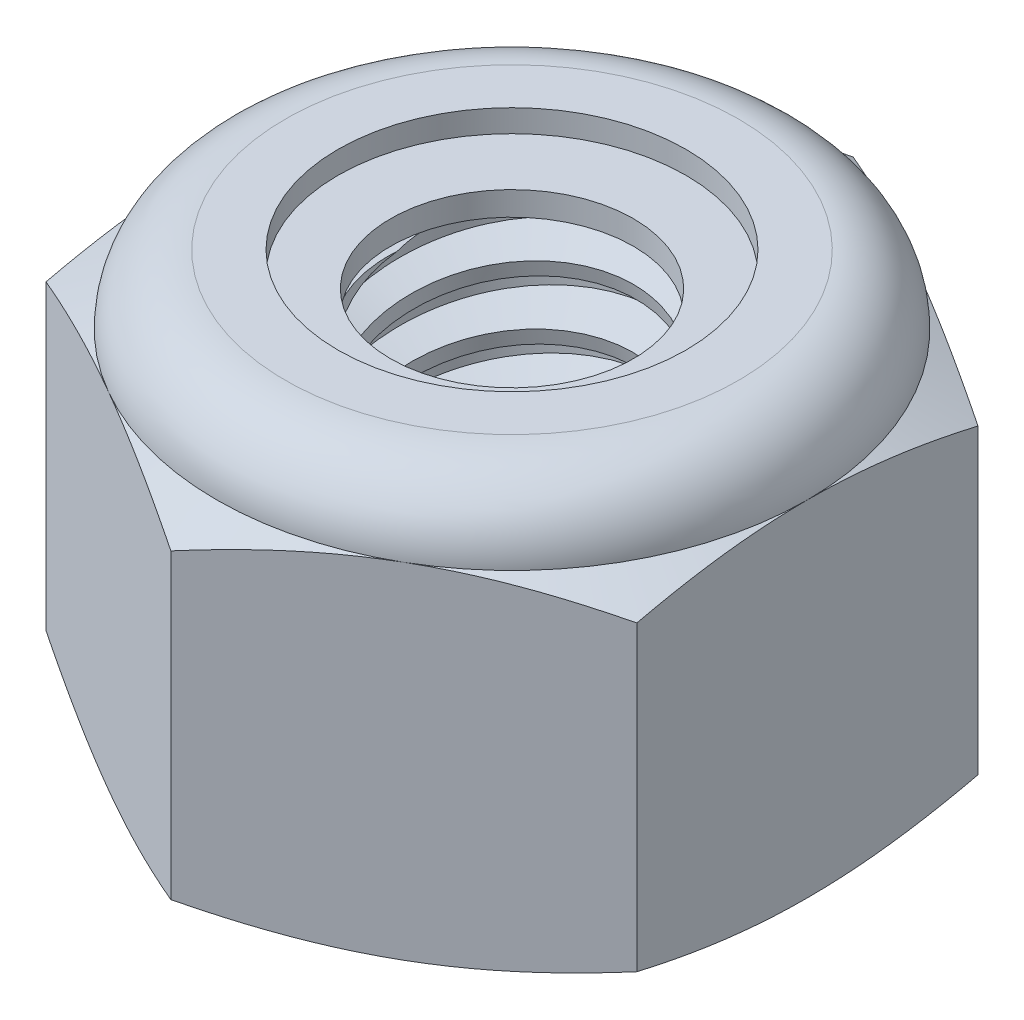
from build123d import *

# Parameters (mm, degrees)
EXTRUDE1_DEPTH      = 2.8
SKETCH2_W           = 1
SKETCH2_H           = 2.8
LPATTERN1_COUNT     = 7
LPATTERN1_PITCH     = 0.4
LPATTERN1_COL_COUNT = 2
LPATTERN1_COL_PITCH = 0.4


with BuildPart() as part:
    # Sketch1 → Extrude1 (new body)
    with BuildSketch(Plane(origin=(0, 0, 0), x_dir=(1, 0, 0), z_dir=(0, 1, 0))):
        Polygon((0, 2.309401077), (-2, 1.154700538), (-2, -1.154700538), (0, -2.309401077), (2, -1.154700538), (2, 1.154700538), align=None)
    extrude(amount=EXTRUDE1_DEPTH)

    # Sketch4 → Cut-Revolve2 (revolve, cut)
    with BuildSketch(Plane(origin=(0, 0, 0), x_dir=(0, 0, -1), z_dir=(1, 0, 0)), mode=Mode.PRIVATE) as cut_revolve2_sk:
        Polygon((0, 2.8), (1, 2.8), (0.82201838, 2.717005807), (0.82201838, 0.082994193), (1, 0), (0, 0), align=None)
    revolve(cut_revolve2_sk.sketch.rotate(Axis((0, 2.8, 0), (0, 1, 0)), 54.619043446), axis=Axis((0, 2.8, 0), (0, 1, 0)), mode=Mode.SUBTRACT)


with BuildPart() as body_2:
    # Sketch2 → Revolve1 (revolve)
    with BuildSketch(Plane(origin=(0, 0, 0), x_dir=(0, 0, -1), z_dir=(1, 0, 0))):
        with Locations((0.5, 1.4)):
            Rectangle(SKETCH2_W, SKETCH2_H)
    revolve(axis=Axis((0, -1, 0), (0, 1, 0)))

    # Sketch3 → Cut-Revolve1 (revolve, cut)
    with BuildSketch(Plane(origin=(0, 0, 0), x_dir=(0, 0, -1), z_dir=(1, 0, 0)), mode=Mode.PRIVATE) as cut_revolve1_sk:
        Polygon((1.009805807, 2.750970966), (1.078446454, 2.40776773), (0.841629993, 2.487879925), (0.82201838, 2.585937993), align=None)
    cut_revolve1 = revolve(cut_revolve1_sk.sketch.rotate(Axis((0, 2.8, 0.085891176), (0, -0.9805806756909201, -0.19611613513818418)), 180), axis=Axis((0, 2.8, 0.085891176), (0, -0.9805806756909201, -0.19611613513818418)), mode=Mode.SUBTRACT)

    # LPattern1: Cut-Revolve1 ×7
    with Locations(*[(0, -i * LPATTERN1_PITCH, 0) for i in range(1, LPATTERN1_COUNT)]):
        add(cut_revolve1, mode=Mode.SUBTRACT)

    # LPattern1 col: Cut-Revolve1 ×2
    with Locations(*[(0, i * LPATTERN1_COL_PITCH, 0) for i in range(1, LPATTERN1_COL_COUNT)]):
        add(cut_revolve1, mode=Mode.SUBTRACT)


with BuildPart() as part_1:
    add(part.part)

    # Combine1: cut body 2
    add(body_2.part, mode=Mode.SUBTRACT)

    # Sketch5 → Cut-Revolve3 (revolve, cut)
    with BuildSketch(Plane(origin=(0, 0, 0), x_dir=(0, 0, -1), z_dir=(1, 0, 0)), mode=Mode.PRIVATE) as cut_revolve3_sk:
        with BuildLine():
            Line((0, 0), (2, 0))
            Line((2, 0), (2.309401077, 0.144276092))
            Line((2.309401077, 0.144276092), (2.309401077, 2.189057242))
            Line((2.309401077, 2.189057242), (2, 2.333333333))
            ThreePointArc((2, 2.333333333), (1.863316498, 2.663316498), (1.533333333, 2.8))
            Line((1.533333333, 2.8), (1.533333333, 4.07))
            Line((1.533333333, 4.07), (3.579401077, 4.07))
            Line((3.579401077, 4.07), (3.579401077, -1.27))
            Line((3.579401077, -1.27), (0, -1.27))
            Line((0, -1.27), (0, 0))
        make_face()
    revolve(cut_revolve3_sk.sketch.rotate(Axis((0, 0, 0), (0, 1, 0)), 54.619043446), axis=Axis((0, 0, 0), (0, 1, 0)), mode=Mode.SUBTRACT)

    # Sketch6 → Cut-Revolve4 (revolve, cut)
    with BuildSketch(Plane(origin=(0, 0, 0), x_dir=(0, 0, -1), z_dir=(1, 0, 0)), mode=Mode.PRIVATE) as cut_revolve4_sk:
        with BuildLine():
            Line((0, 2.333333333), (1.8476, 2.333333333))
            ThreePointArc((1.8476, 2.333333333), (1.755553424, 2.555553424), (1.533333333, 2.6476))
            Line((1.533333333, 2.6476), (1.177675857, 2.6476))
            Line((1.177675857, 2.6476), (1.177675857, 4.07))
            Line((1.177675857, 4.07), (0, 4.07))
            Line((0, 4.07), (0, 2.333333333))
        make_face()
    revolve(cut_revolve4_sk.sketch.rotate(Axis((0, 4.07, 0), (0, 1, 0)), 54.619043446), axis=Axis((0, 4.07, 0), (0, 1, 0)), mode=Mode.SUBTRACT)


with BuildPart() as body_2_2:
    # Sketch7 → Revolve2 (revolve)
    with BuildSketch(Plane(origin=(0, 0, 0), x_dir=(0, 0, -1), z_dir=(1, 0, 0))):
        with BuildLine():
            Line((0.82201838, 2.409533333), (1.758875564, 2.409533333))
            ThreePointArc((1.758875564, 2.409533333), (1.672140858, 2.526745352), (1.533333333, 2.5714))
            Line((1.533333333, 2.5714), (0.82201838, 2.5714))
            Line((0.82201838, 2.5714), (0.82201838, 2.409533333))
        make_face()
    revolve(axis=Axis((0, 2.409533333, 0), (0, 1, 0)))


solid = Compound([part_1.part, body_2_2.part])
